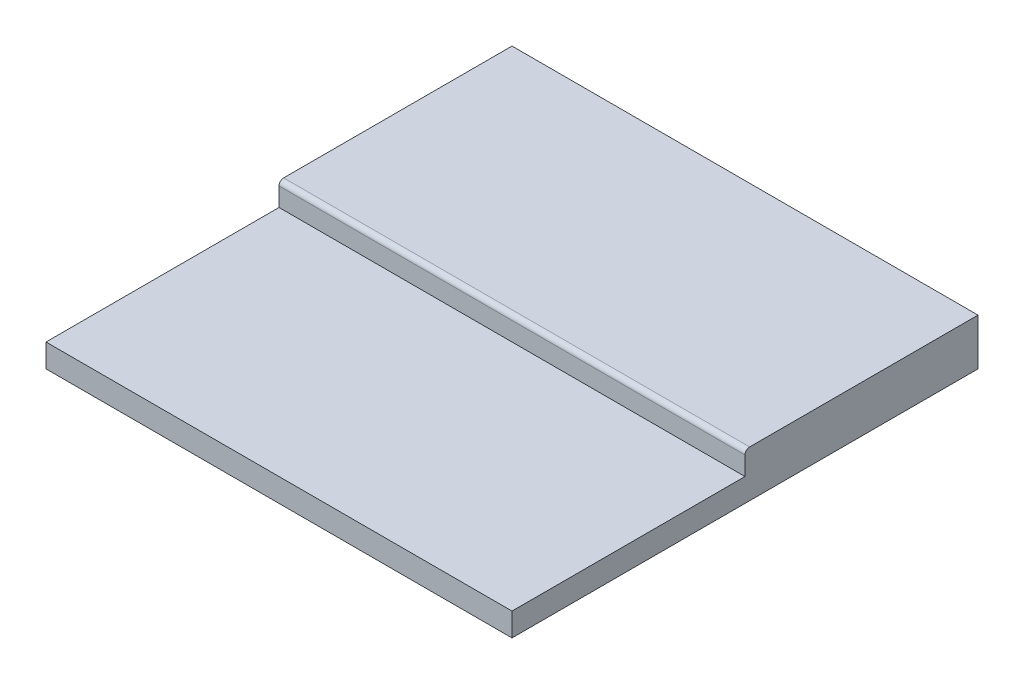
from build123d import *

# Parameters (mm, degrees)
SKETCH1_W           = 2000
SKETCH1_H           = 2000
BOSS_EXTRUDE1_DEPTH = 100
SKETCH2_W           = 2000
SKETCH2_H           = 1000
BOSS_EXTRUDE2_DEPTH = 100
FILLET1_R           = 20


with BuildPart() as part:
    # Sketch1 → Boss-Extrude1 (new body)
    with BuildSketch(Plane(origin=(0, 0, 0), x_dir=(1, 0, 0), z_dir=(0, 1, 0))):
        with Locations((1000, 1000)):
            Rectangle(SKETCH1_W, SKETCH1_H)
    extrude(amount=BOSS_EXTRUDE1_DEPTH)

    # Sketch2 → Boss-Extrude2 (add)
    with BuildSketch(Plane(origin=(0, 100, 0), x_dir=(1, 0, 0), z_dir=(0, 1, 0))):
        with Locations((1000, 1500)):
            Rectangle(SKETCH2_W, SKETCH2_H)
    extrude(amount=BOSS_EXTRUDE2_DEPTH)

    # Fillet1
    fillet1_edges = [part.edges().sort_by_distance(p)[0] for p in [
        (1000, 200, -1000),
    ]]
    fillet(fillet1_edges, radius=FILLET1_R)


solid = part.part
